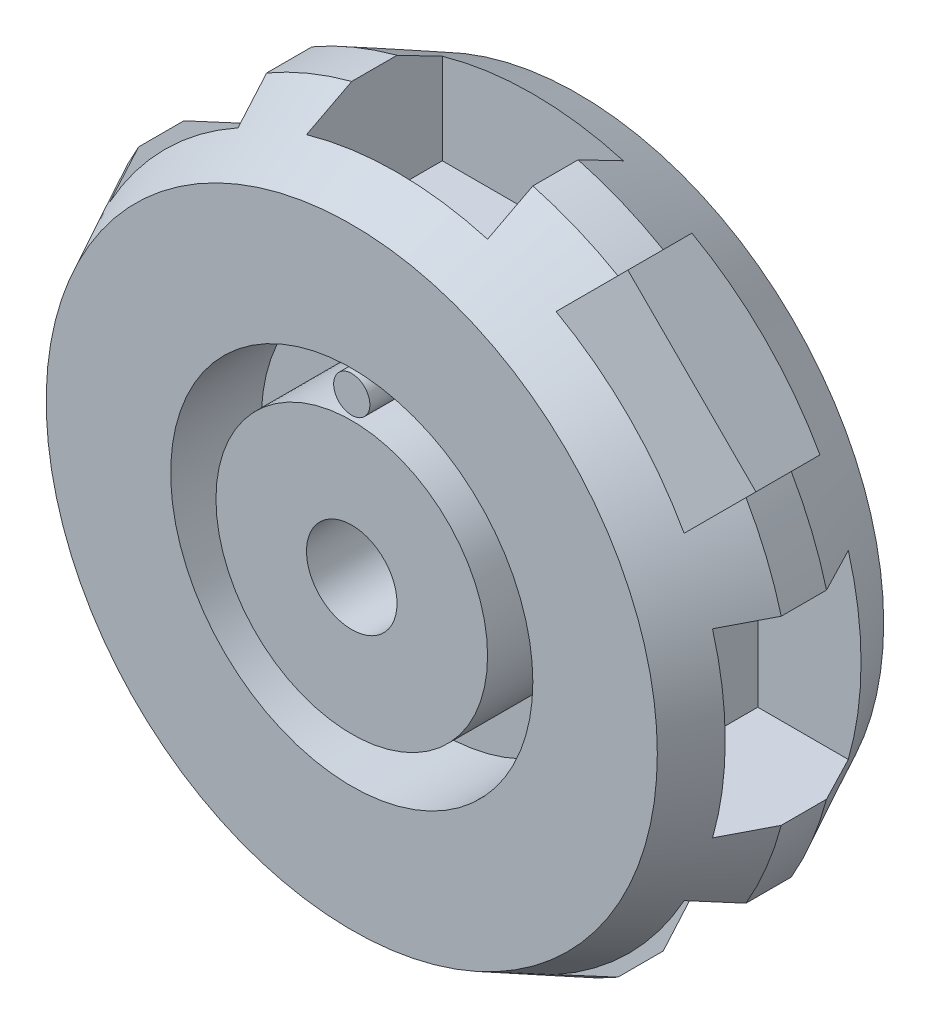
from build123d import *

# Parameters (mm, degrees)
SKETCH1_R           = 24.60625
SKETCH1_R_2         = 3.175
BOSS_EXTRUDE1_DEPTH = 15.875
SKETCH2_R           = 12.7
SKETCH2_R_2         = 9.525
CUT_EXTRUDE1_DEPTH  = 6.35
CUT_EXTRUDE3_START  = -6.35
SKETCH4_R           = 12.7
SKETCH4_R_2         = 9.525
CUT_EXTRUDE3_DEPTH  = 6.35
CHAMFER1_SIZE       = 3.175
CHAMFER1_SIZE2      = 6.35
CHAMFER2_SIZE       = 6.35
CHAMFER2_SIZE2      = 3.175
CUT_EXTRUDE5_DEPTH  = 39.248538575
CIRPATTERN2_COUNT   = 8
SKETCH6_R           = 1.27
BOSS_EXTRUDE2_DEPTH = 6.35
SKETCH9_R           = 1.27
BOSS_EXTRUDE3_DEPTH = 6.35
CUT_EXTRUDE6_REACH  = 43.528
CIRPATTERN3_COUNT   = 8
SKETCH16_W          = 12.7
SKETCH16_H          = 9.525
CUT_EXTRUDE7_DEPTH  = 6.35
CIRPATTERN4_COUNT   = 8


with BuildPart() as part:
    # Sketch1 → Boss-Extrude1 (new body)
    with BuildSketch(Plane.XY):
        Circle(SKETCH1_R)
        Circle(SKETCH1_R_2, mode=Mode.SUBTRACT)
    extrude(amount=BOSS_EXTRUDE1_DEPTH)

    # Sketch2 → Cut-Extrude1 (cut)
    with BuildSketch(Plane.XY.offset(15.875)):
        Circle(SKETCH2_R)
        Circle(SKETCH2_R_2, mode=Mode.SUBTRACT)
    extrude(amount=-CUT_EXTRUDE1_DEPTH, mode=Mode.SUBTRACT)

    # Sketch4 → Cut-Extrude3 (cut)
    with BuildSketch(Plane(origin=(0, 0, 0), x_dir=(-1, 0, 0), z_dir=(0, 0, -1)).offset(CUT_EXTRUDE3_START)):
        Circle(SKETCH4_R)
        Circle(SKETCH4_R_2, mode=Mode.SUBTRACT)
    extrude(amount=CUT_EXTRUDE3_DEPTH, mode=Mode.SUBTRACT)

    # Chamfer1
    chamfer1_edges = [part.edges().sort_by_distance(p)[0] for p in [
        (-24.60625, 0, 0),
    ]]
    chamfer1_side = [part.faces().sort_by_distance(p)[0] for p in [
        (-23.910280151, 0, 0),
    ]]
    chamfer(chamfer1_edges, length=CHAMFER1_SIZE, length2=CHAMFER1_SIZE2, reference=chamfer1_side[0])

    # Chamfer2
    chamfer2_edges = [part.edges().sort_by_distance(p)[0] for p in [
        (-24.60625, 0, 15.875),
    ]]
    chamfer2_side = [part.faces().sort_by_distance(p)[0] for p in [
        (-24.60625, 0, 11.1125),
    ]]
    chamfer(chamfer2_edges, length=CHAMFER2_SIZE, length2=CHAMFER2_SIZE2, reference=chamfer2_side[0])

    # Sketch5 → Cut-Extrude5 (cut, through all)
    with BuildSketch(Plane(origin=(0, 0, 0), x_dir=(-1, 0, 0), z_dir=(0, 0, -1))):
        with BuildLine():
            Line((-6.35, 26.286223353), (6.35, 26.286223353))
            Line((6.35, 26.286223353), (6.35, 22.125558785))
            ThreePointArc((6.35, 22.125558785), (0, 23.01875), (-6.35, 22.125558785))
            Line((-6.35, 22.125558785), (-6.35, 26.286223353))
        make_face()
    cut_extrude5 = extrude(amount=-CUT_EXTRUDE5_DEPTH, mode=Mode.SUBTRACT)

    # CirPattern2: Cut-Extrude5 ×8 about axis
    cirpattern2_axis = Axis((0, 0, 15.875), (0, 0, -1))
    for i in range(1, CIRPATTERN2_COUNT):
        add(cut_extrude5.rotate(cirpattern2_axis, i * 360 / CIRPATTERN2_COUNT), mode=Mode.SUBTRACT)

    # Sketch6 → Boss-Extrude2 (add)
    with BuildSketch(Plane(origin=(0, 0, 6.35), x_dir=(-1, 0, 0), z_dir=(0, 0, -1))):
        with Locations((0, -11.1125)):
            Circle(SKETCH6_R)
    extrude(amount=BOSS_EXTRUDE2_DEPTH)

    # Sketch9 → Boss-Extrude3 (add)
    with BuildSketch(Plane.XY.offset(9.525)):
        with Locations((0, 11.1125)):
            Circle(SKETCH9_R)
    extrude(amount=BOSS_EXTRUDE3_DEPTH)

    # Sketch14 → Cut-Extrude6 (cut, up to next)
    with BuildSketch(Plane.ZY.offset(-6.35), mode=Mode.PRIVATE) as cut_extrude6_sk1:
        Polygon((6.35, 23.772779372), (9.525, 23.772779372), (12.7, 22.125558785), (3.175, 22.125558785), align=None)
    cut_extrude6_tool1 = extrude(cut_extrude6_sk1.sketch, amount=CUT_EXTRUDE6_REACH, mode=Mode.PRIVATE) & part.part
    cut_extrude6 = cut_extrude6_tool1.solids().sort_by_distance((6.35, 22.811901, 7.9375))[0]
    add(cut_extrude6, mode=Mode.SUBTRACT)

    # CirPattern3: Cut-Extrude6 ×8 about axis
    cirpattern3_axis = Axis((0, 0, 15.875), (0, 0, -1))
    for i in range(1, CIRPATTERN3_COUNT):
        add(cut_extrude6.rotate(cirpattern3_axis, i * 360 / CIRPATTERN3_COUNT), mode=Mode.SUBTRACT)

    # Sketch16 → Cut-Extrude7 (cut, symmetric)
    with BuildSketch(Plane(origin=(0, 22.125558785, 0), x_dir=(1, 0, 0), z_dir=(0, 1, 0))):
        with Locations((0, -7.9375)):
            Rectangle(SKETCH16_W, SKETCH16_H)
    cut_extrude7 = extrude(amount=CUT_EXTRUDE7_DEPTH, both=True, mode=Mode.SUBTRACT)

    # CirPattern4: Cut-Extrude7 ×8 about axis
    cirpattern4_axis = Axis((0, 0, 15.875), (0, 0, -1))
    for i in range(1, CIRPATTERN4_COUNT):
        add(cut_extrude7.rotate(cirpattern4_axis, i * 360 / CIRPATTERN4_COUNT), mode=Mode.SUBTRACT)


solid = part.part
